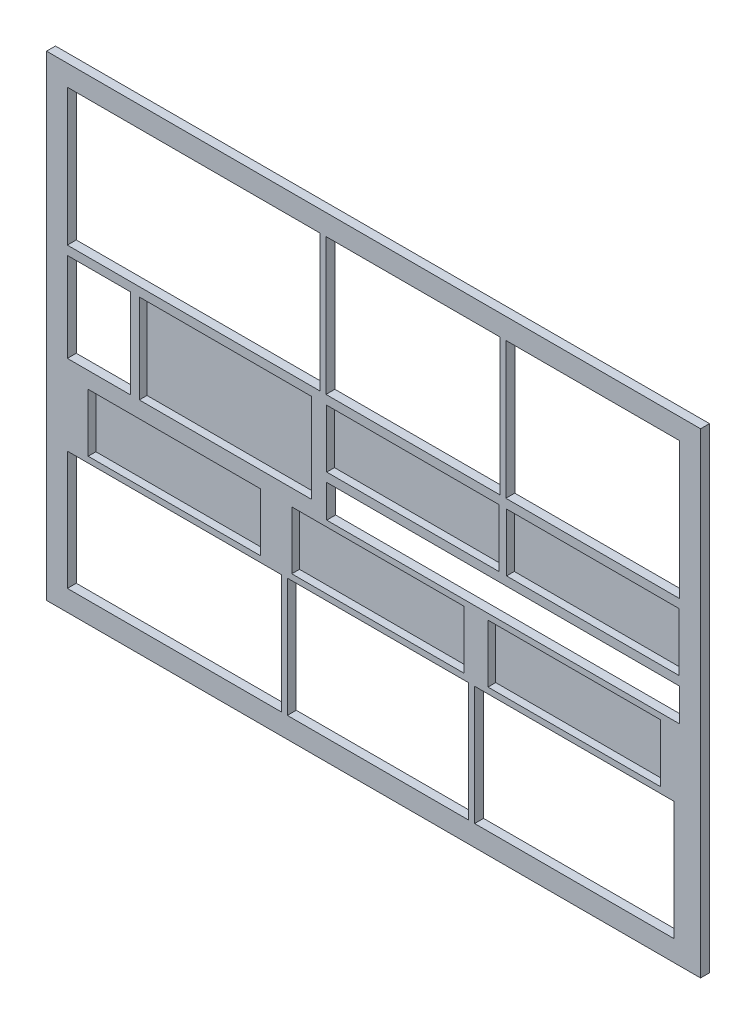
from build123d import *

# Parameters (mm, degrees)
SKETCH_1_W          = 220
SKETCH_1_H          = 160
EXTRUDE_1_DEPTH     = 3
SKETCH_2_W          = 85
SKETCH_2_H          = 46
SKETCH_2_W_2        = 58.5
CUT_EXTRUDE_1_DEPTH = 137.047785723
CUT_EXTRUDE_2_REACH = 138.048
SKETCH_3_W          = 21.2
SKETCH_3_H          = 30
SKETCH_4_W          = 58
SKETCH_4_H          = 30
SKETCH_4_H_2        = 19.5
CUT_EXTRUDE_3_DEPTH = 2.6
SKETCH_6_W          = 118.75
SKETCH_6_H          = 11
CUT_EXTRUDE_4_DEPTH = 137.047785723
CUT_EXTRUDE_5_REACH = 138.048
SKETCH_7_W          = 72
SKETCH_7_H          = 40
SKETCH_7_W_2        = 61
SKETCH_7_W_3        = 67
SKETCH_8_W          = 58
SKETCH_8_H          = 19.5
CUT_EXTRUDE_6_DEPTH = 2.6


with BuildPart() as part:
    # 草图1 → 凸台-拉伸1 (new body)
    with BuildSketch(Plane.XY):
        Rectangle(SKETCH_1_W, SKETCH_1_H)
    extrude(amount=EXTRUDE_1_DEPTH)

    # 草图2 → 切除-拉伸1 (cut, through all)
    with BuildSketch(Plane.XY.offset(3)):
        with Locations((-60.5, 50)):
            Rectangle(SKETCH_2_W, SKETCH_2_H)
        with Locations((13.25, 50)):
            Rectangle(SKETCH_2_W_2, SKETCH_2_H)
        with Locations((73.75, 50)):
            Rectangle(SKETCH_2_W_2, SKETCH_2_H)
    extrude(amount=-CUT_EXTRUDE_1_DEPTH, mode=Mode.SUBTRACT)

    # 草图3 → 切除-拉伸2 (cut, up to next)
    with BuildSketch(Plane.XY.offset(3), mode=Mode.PRIVATE) as cut_extrude_2_sk1:
        with Locations((-92.4, 9)):
            Rectangle(SKETCH_3_W, SKETCH_3_H)
    cut_extrude_2_tool1 = extrude(cut_extrude_2_sk1.sketch, amount=-CUT_EXTRUDE_2_REACH, mode=Mode.PRIVATE) & part.part
    add(cut_extrude_2_tool1.solids().sort_by_distance((-92.4, 9, 3))[0], mode=Mode.SUBTRACT)

    # 草图4 → 切除-拉伸3 (cut)
    with BuildSketch(Plane.XY.offset(3)):
        with Locations((-49.8, 9)):
            Rectangle(SKETCH_4_W, SKETCH_4_H)
        with Locations((13.25, 14.25)):
            Rectangle(SKETCH_4_W, SKETCH_4_H_2)
        with Locations((73.75, 14.25)):
            Rectangle(SKETCH_4_W, SKETCH_4_H_2)
    extrude(amount=-CUT_EXTRUDE_3_DEPTH, mode=Mode.SUBTRACT)

    # 草图6 → 切除-拉伸4 (cut, through all)
    with BuildSketch(Plane.XY.offset(3)):
        with Locations((43.625, -4)):
            Rectangle(SKETCH_6_W, SKETCH_6_H)
    extrude(amount=-CUT_EXTRUDE_4_DEPTH, mode=Mode.SUBTRACT)

    # 草图7 → 切除-拉伸5 (cut, up to next)
    with BuildSketch(Plane.XY.offset(3), mode=Mode.PRIVATE) as cut_extrude_5_sk1:
        with Locations((-67, -53)):
            Rectangle(SKETCH_7_W, SKETCH_7_H)
    cut_extrude_5_tool1 = extrude(cut_extrude_5_sk1.sketch, amount=-CUT_EXTRUDE_5_REACH, mode=Mode.PRIVATE) & part.part
    # 草图7 → 切除-拉伸5 (cut, up to next)
    with BuildSketch(Plane.XY.offset(3), mode=Mode.PRIVATE) as cut_extrude_5_sk2:
        with Locations((1.5, -53)):
            Rectangle(SKETCH_7_W_2, SKETCH_7_H)
    cut_extrude_5_tool2 = extrude(cut_extrude_5_sk2.sketch, amount=-CUT_EXTRUDE_5_REACH, mode=Mode.PRIVATE) & part.part
    # 草图7 → 切除-拉伸5 (cut, up to next)
    with BuildSketch(Plane.XY.offset(3), mode=Mode.PRIVATE) as cut_extrude_5_sk3:
        with Locations((67.5, -53)):
            Rectangle(SKETCH_7_W_3, SKETCH_7_H)
    cut_extrude_5_tool3 = extrude(cut_extrude_5_sk3.sketch, amount=-CUT_EXTRUDE_5_REACH, mode=Mode.PRIVATE) & part.part
    add(cut_extrude_5_tool1.solids().sort_by_distance((-67, -53, 3))[0], mode=Mode.SUBTRACT)
    add(cut_extrude_5_tool2.solids().sort_by_distance((1.5, -53, 3))[0], mode=Mode.SUBTRACT)
    add(cut_extrude_5_tool3.solids().sort_by_distance((67.5, -53, 3))[0], mode=Mode.SUBTRACT)

    # 草图8 → 切除-拉伸6 (cut)
    with BuildSketch(Plane.XY.offset(3)):
        with Locations((-67, -21.25)):
            Rectangle(SKETCH_8_W, SKETCH_8_H)
        with Locations((1.5, -21.25)):
            Rectangle(SKETCH_8_W, SKETCH_8_H)
        with Locations((67.5, -21.25)):
            Rectangle(SKETCH_8_W, SKETCH_8_H)
    extrude(amount=-CUT_EXTRUDE_6_DEPTH, mode=Mode.SUBTRACT)


solid = part.part
